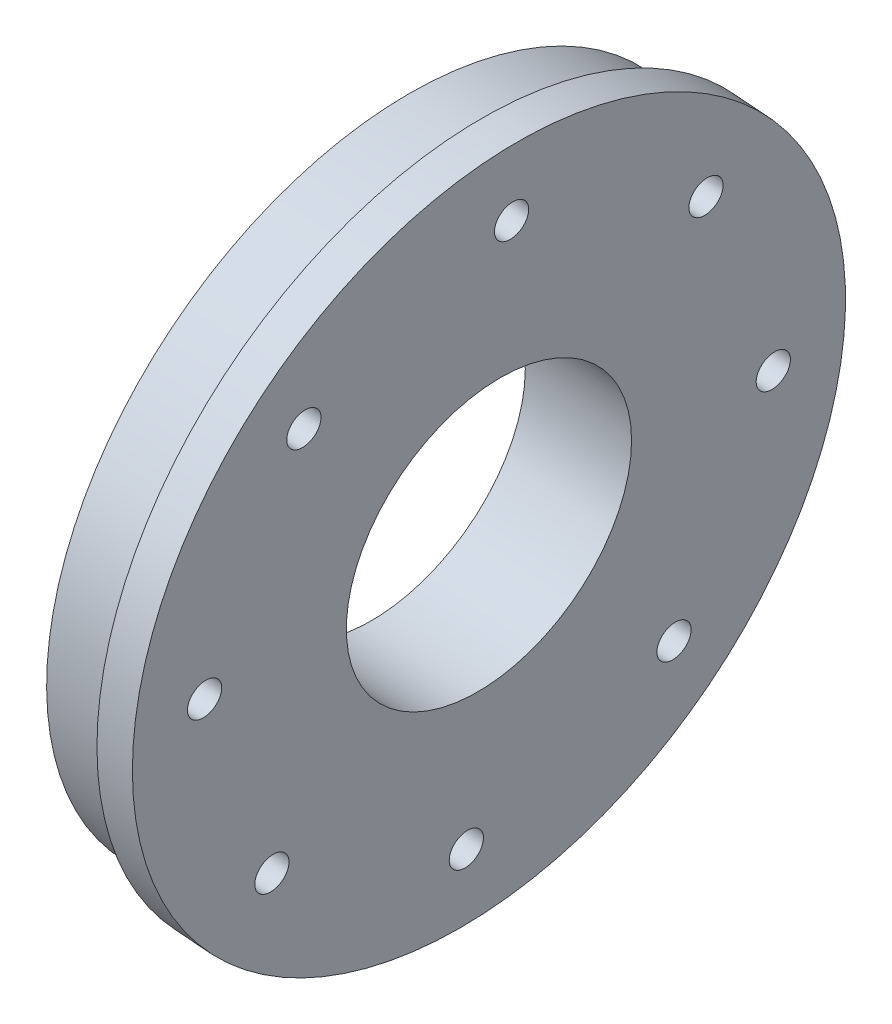
from build123d import *

# Parameters (mm, degrees)
SKETCH1_R           = 14.9606
BOSS_EXTRUDE1_DEPTH = 4.7625
SKETCH2_R           = 6.35
CUT_EXTRUDE1_DEPTH  = 6.35
SKETCH3_R           = 0.762
CUT_EXTRUDE2_DEPTH  = 10
SKETCH5_R           = 15.875
SKETCH5_R_2         = 14.9606
BOSS_EXTRUDE2_DEPTH = 1.5875


with BuildPart() as part:
    # Sketch1 → Boss-Extrude1 (new body)
    with BuildSketch(Plane(origin=(234.278878836, -18.689027227, 0), x_dir=(0, 0, -1), z_dir=(0.9968332748770866, -0.0795199477981641, 0))):
        with Locations((-43.174261814, 8.550344032)):
            Circle(SKETCH1_R)
    extrude(amount=-BOSS_EXTRUDE1_DEPTH)

    # Sketch2 → Cut-Extrude1 (cut)
    with BuildSketch(Plane(origin=(234.278878836, -18.689027227, 0), x_dir=(0, 0, -1), z_dir=(0.9968332748770866, -0.07951994779816411, 0))):
        with Locations((-43.174261814, 8.550344032)):
            Circle(SKETCH2_R)
    extrude(amount=-CUT_EXTRUDE1_DEPTH, mode=Mode.SUBTRACT)

    # Sketch3 → Cut-Extrude2 (cut)
    with BuildSketch(Plane(origin=(229.531460364, -18.310313476, 0), x_dir=(0, 0, 1), z_dir=(-0.9968332748770866, 0.07951994779816411, 0))):
        with Locations((43.174261814, 21.250344032)):
            Circle(SKETCH3_R)
        with Locations((52.154517935, 17.530600153)):
            Circle(SKETCH3_R)
        with Locations((55.874261814, 8.550344032)):
            Circle(SKETCH3_R)
        with Locations((52.154517935, -0.429912089)):
            Circle(SKETCH3_R)
        with Locations((43.174261814, -4.149655968)):
            Circle(SKETCH3_R)
        with Locations((34.194005693, -0.429912089)):
            Circle(SKETCH3_R)
        with Locations((30.474261814, 8.550344032)):
            Circle(SKETCH3_R)
        with Locations((34.194005693, 17.530600153)):
            Circle(SKETCH3_R)
    extrude(amount=-CUT_EXTRUDE2_DEPTH, mode=Mode.SUBTRACT)

    # Sketch5 → Boss-Extrude2 (add)
    with BuildSketch(Plane(origin=(234.278878836, -18.689027227, 0), x_dir=(0, 0, 1), z_dir=(-0.9968332748770866, 0.07951994779816411, 0))):
        with Locations((43.174261814, 8.550344032)):
            Circle(SKETCH5_R)
        with Locations((43.174261814, 8.550344032)):
            Circle(SKETCH5_R_2, mode=Mode.SUBTRACT)
    extrude(amount=BOSS_EXTRUDE2_DEPTH)


solid = part.part
